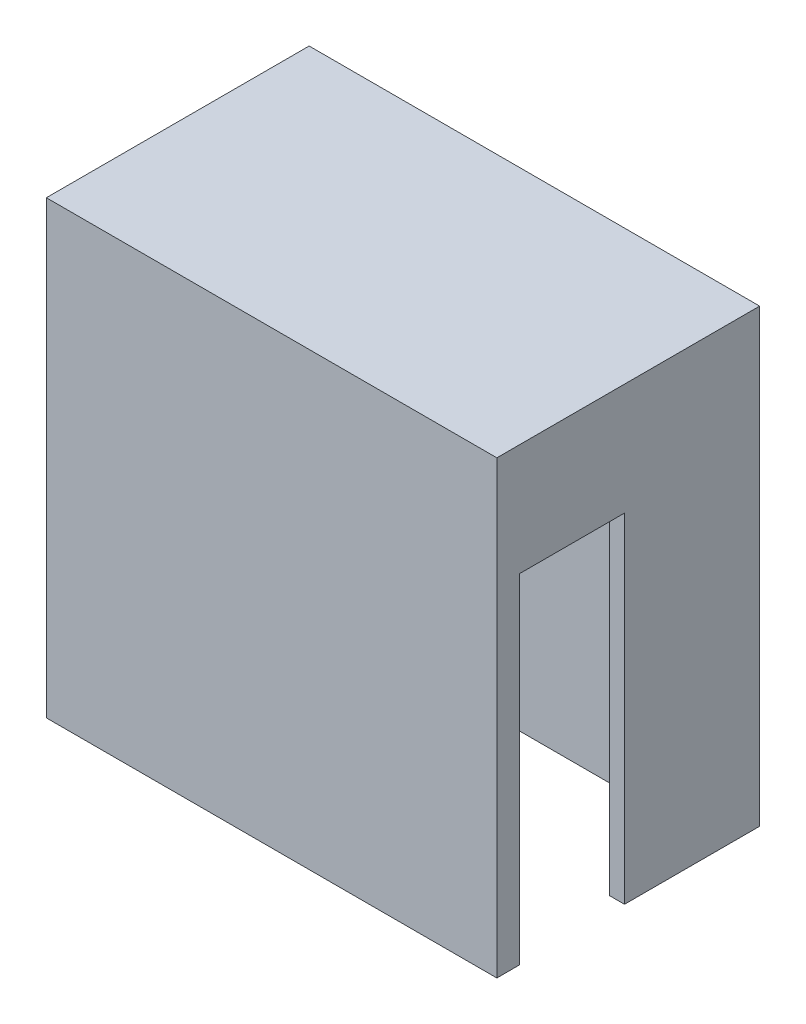
from build123d import *

# Parameters (mm, degrees)
SKETCH1_W           = 38.1
SKETCH1_H           = 22.225
BOSS_EXTRUDE2_DEPTH = 38.1
SKETCH4_W           = 35.56
SKETCH4_H           = 12.7
CUT_EXTRUDE1_DEPTH  = 31.75
SKETCH5_W           = 8.89
SKETCH5_H           = 29.21
CUT_EXTRUDE3_DEPTH  = 59.285252208


with BuildPart() as part:
    # Sketch1 → Boss-Extrude2 (new body)
    with BuildSketch(Plane(origin=(0, 0, 0), x_dir=(1, 0, 0), z_dir=(0, 1, 0))):
        with Locations((19.05, 11.1125)):
            Rectangle(SKETCH1_W, SKETCH1_H)
    extrude(amount=BOSS_EXTRUDE2_DEPTH)

    # Sketch4 → Cut-Extrude1 (cut)
    with BuildSketch(Plane.XZ):
        with Locations((19.05, -12.7)):
            Rectangle(SKETCH4_W, SKETCH4_H)
    extrude(amount=-CUT_EXTRUDE1_DEPTH, mode=Mode.SUBTRACT)

    # Sketch5 → Cut-Extrude3 (cut, through all)
    with BuildSketch(Plane.ZY):
        with Locations((-6.350275286, 14.051077043)):
            Rectangle(SKETCH5_W, SKETCH5_H)
    extrude(amount=-CUT_EXTRUDE3_DEPTH, mode=Mode.SUBTRACT)


solid = part.part
